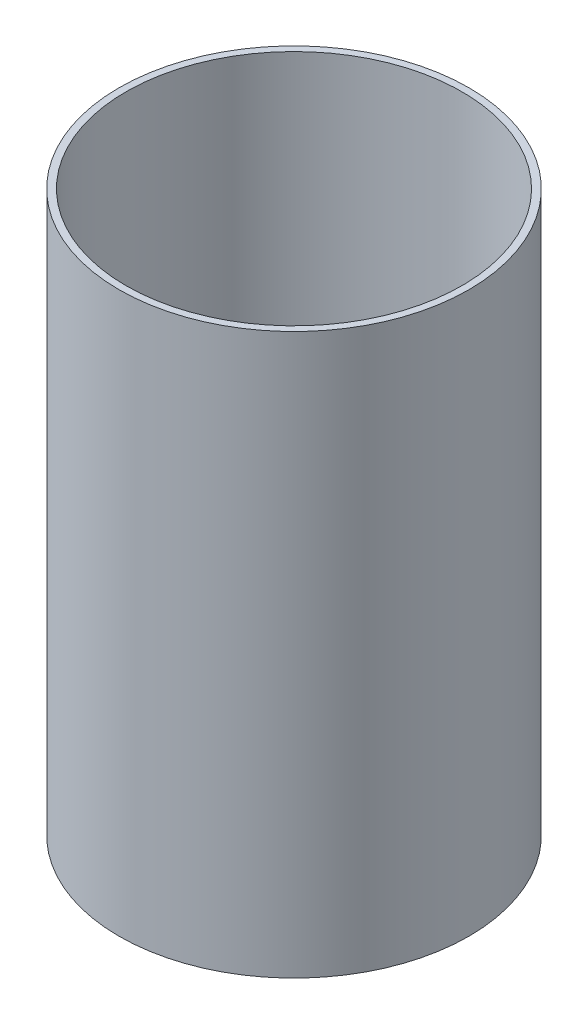
from build123d import *

# Parameters (mm, degrees)
SKETCH_1_R      = 39.6748
SKETCH_1_R_2    = 38.1
EXTRUDE_1_DEPTH = 63.5


with BuildPart() as part:
    # 草图1 → 凸台-拉伸1 (new, symmetric)
    with BuildSketch(Plane(origin=(0, 0, 0), x_dir=(1, 0, 0), z_dir=(0, 1, 0))):
        with Locations(Location((0, 0, 0), (0, 0, 270))):
            Circle(SKETCH_1_R)
        with Locations(Location((0, 0, 0), (0, 0, 270))):
            Circle(SKETCH_1_R_2, mode=Mode.SUBTRACT)
    extrude(amount=EXTRUDE_1_DEPTH, both=True)


solid = part.part
